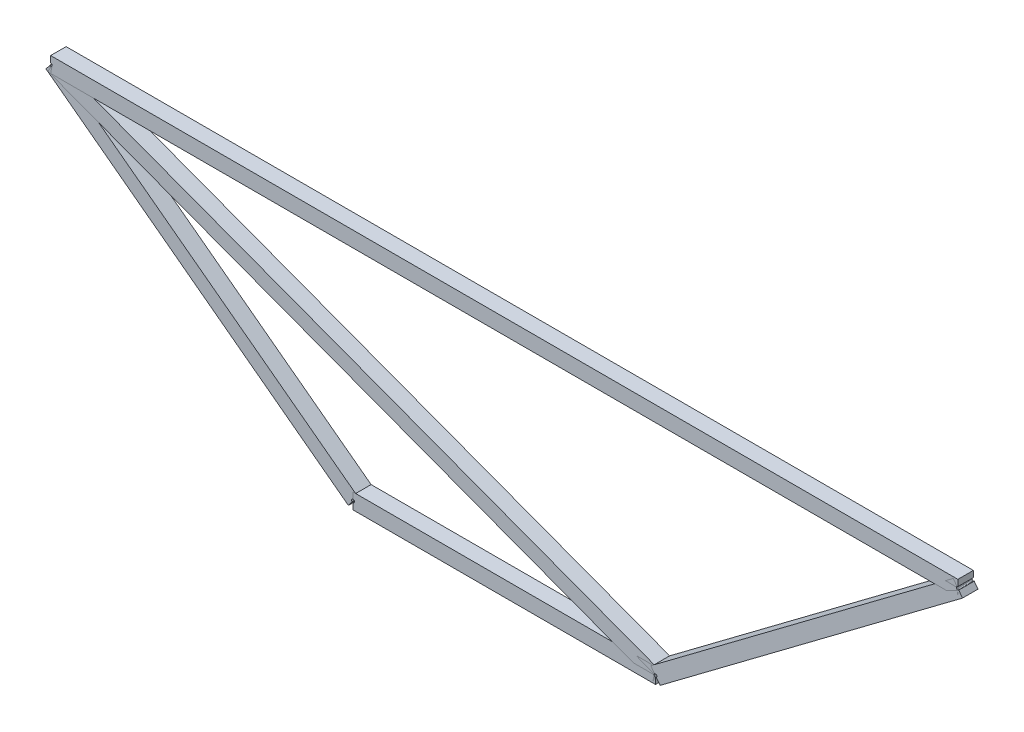
from build123d import *

# Parameters (mm, degrees)
SKETCH129_W              = 20.47557081
SKETCH129_H              = 20.47557081
SKETCH130_W              = 20.47557081
SKETCH130_H              = 20.47557081
SKETCH131_W              = 20.47557081
SKETCH131_H              = 20.47557081
SKETCH135_W              = 20.47557081
SKETCH135_H              = 20.47557081
SKETCH134_W              = 20.47557081
SKETCH134_H              = 20.47557081
CUT_EXTRUDE10_DEPTH      = 865.021260671
CUT_EXTRUDE10_DEPTH_BACK = 865.021260671
SKETCH154_R              = 1.902917041


with BuildPart() as part:
    # Sweep3: sweep along a path in Sketch2
    with BuildLine(Plane.XY) as sweep3_path:
        Line((-400, 300), (800, 300))
    # Sketch129 → Sweep3 (sweep)
    with BuildSketch(Plane(origin=(0, 0, 0), x_dir=(0, 0, -1), z_dir=(1, 0, 0))):
        with Locations((0, 300)):
            Rectangle(SKETCH129_W, SKETCH129_H)
    sweep(path=sweep3_path.line)


with BuildPart() as body_2:
    # Sweep4: sweep along a path in Sketch123
    with BuildLine(Plane.XY) as sweep4_path:
        Line((0, 0), (400, 0))
    # Sketch130 → Sweep4 (sweep)
    with BuildSketch(Plane(origin=(0, 0, 0), x_dir=(0, 0, -1), z_dir=(1, 0, 0))):
        Rectangle(SKETCH130_W, SKETCH130_H)
    sweep(path=sweep4_path.line)


with BuildPart() as body_3:
    # Sweep5: sweep along a path in Sketch126
    with BuildLine(Plane.XY) as sweep5_path:
        Line((400, 0), (800, 300))
    # Sketch131 → Sweep5 (sweep)
    with BuildSketch(Plane(origin=(800, 300, 0), x_dir=(0, 0, 1), z_dir=(-0.8, -0.6, 0))):
        Rectangle(SKETCH131_W, SKETCH131_H)
    sweep(path=sweep5_path.line)


with BuildPart() as body_4:
    # Sweep6: sweep along a path in Sketch125
    with BuildLine(Plane.XY) as sweep6_path:
        Line((-400, 300), (400, 0))
    # Sketch135 → Sweep6 (sweep)
    with BuildSketch(Plane(origin=(400, 0, 0), x_dir=(0, 0, -1), z_dir=(0.9363291775690445, -0.35112344158839176, 0))):
        Rectangle(SKETCH135_W, SKETCH135_H)
    sweep(path=sweep6_path.line)


with BuildPart() as body_5:
    # Sweep7: sweep along a path in Sketch124
    with BuildLine(Plane.XY) as sweep7_path:
        Line((0, 0), (-400, 300))
    # Sketch134 → Sweep7 (sweep)
    with BuildSketch(Plane(origin=(-400, 300, 0), x_dir=(0, 0, 1), z_dir=(-0.8, 0.6, 0))):
        Rectangle(SKETCH134_W, SKETCH134_H)
    sweep(path=sweep7_path.line)


with BuildPart() as cut_extrude10_tool:
    # Sketch154 → Cut-Extrude10 (new, two sides: drawn at the far end of the back side and taken through both)
    with BuildSketch(Plane(origin=(0, 0, -10.237785405), x_dir=(-1, 0, 0), z_dir=(0, 0, -1)).offset(-CUT_EXTRUDE10_DEPTH_BACK)):
        with Locations((-800, 300)):
            Circle(SKETCH154_R)
        with Locations((-400, 0)):
            Circle(SKETCH154_R)
        Circle(SKETCH154_R)
        with Locations((400, 300)):
            Circle(SKETCH154_R)
    extrude(amount=CUT_EXTRUDE10_DEPTH + CUT_EXTRUDE10_DEPTH_BACK)


with BuildPart() as part_1:
    add(part.part)

    # Cut-Extrude10: cut by cut_extrude10_tool
    add(cut_extrude10_tool.part, mode=Mode.SUBTRACT)


with BuildPart() as body_2_1:
    add(body_2.part)

    # Cut-Extrude10: cut by cut_extrude10_tool
    add(cut_extrude10_tool.part, mode=Mode.SUBTRACT)


with BuildPart() as body_3_1:
    add(body_3.part)

    # Cut-Extrude10: cut by cut_extrude10_tool
    add(cut_extrude10_tool.part, mode=Mode.SUBTRACT)


with BuildPart() as body_4_1:
    add(body_4.part)

    # Cut-Extrude10: cut by cut_extrude10_tool
    add(cut_extrude10_tool.part, mode=Mode.SUBTRACT)


with BuildPart() as body_5_1:
    add(body_5.part)

    # Cut-Extrude10: cut by cut_extrude10_tool
    add(cut_extrude10_tool.part, mode=Mode.SUBTRACT)


solid = Compound([part_1.part, body_2_1.part, body_3_1.part, body_4_1.part, body_5_1.part])
